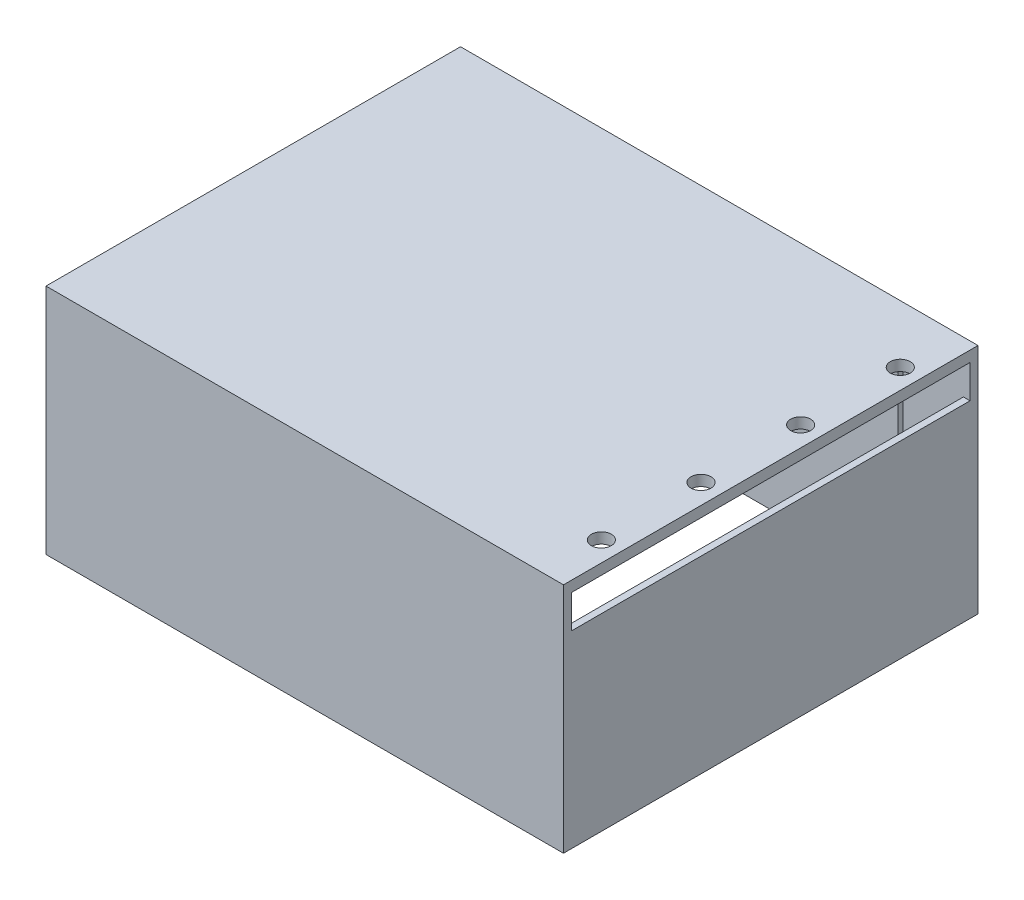
from build123d import *

# Parameters (mm, degrees)
SKETCH1_W           = 77.9
SKETCH1_H           = 62.4
BOSS_EXTRUDE1_DEPTH = 35
SKETCH4_W           = 73.9
SKETCH4_H           = 58.4
CUT_EXTRUDE1_DEPTH  = 33.39
SKETCH7_W           = 13.133474477
SKETCH7_H           = 5
CUT_EXTRUDE6_DEPTH  = 15
SKETCH11_W          = 9.956525523
SKETCH11_H          = 5.15
CUT_EXTRUDE8_DEPTH  = 10
SKETCH12_W          = 17
SKETCH12_H          = 16
CUT_EXTRUDE9_DEPTH  = 10
SKETCH14_W          = 60
SKETCH14_H          = 5
CUT_EXTRUDE10_DEPTH = 10
CUT_EXTRUDE12_START = -33.39
SKETCH16_W          = 9.076585482
SKETCH16_H          = 60
CUT_EXTRUDE12_DEPTH = 33.39
SKETCH15_R          = 1.5
CUT_EXTRUDE11_DEPTH = 10
SKETCH18_W          = 1.605745829
SKETCH18_H          = 60
BOSS_EXTRUDE2_DEPTH = 10


with BuildPart() as part:
    # Sketch1 → Boss-Extrude1 (new body)
    with BuildSketch(Plane(origin=(0, 0, 0), x_dir=(1, 0, 0), z_dir=(0, 1, 0))):
        with Locations((38.95, 31.2)):
            Rectangle(SKETCH1_W, SKETCH1_H)
    extrude(amount=BOSS_EXTRUDE1_DEPTH)

    # Sketch4 → Cut-Extrude1 (cut)
    with BuildSketch(Plane.XZ):
        with Locations((38.95, -31.2)):
            Rectangle(SKETCH4_W, SKETCH4_H)
    extrude(amount=-CUT_EXTRUDE1_DEPTH, mode=Mode.SUBTRACT)

    # Sketch7 → Cut-Extrude6 (cut)
    with BuildSketch(Plane.ZY):
        with Locations((-42.333262762, 2.5)):
            Rectangle(SKETCH7_W, SKETCH7_H)
    extrude(amount=-CUT_EXTRUDE6_DEPTH, mode=Mode.SUBTRACT)

    # Sketch11 → Cut-Extrude8 (cut)
    with BuildSketch(Plane.ZY):
        with Locations((-12.508262762, 2.575)):
            Rectangle(SKETCH11_W, SKETCH11_H)
    extrude(amount=-CUT_EXTRUDE8_DEPTH, mode=Mode.SUBTRACT)

    # Sketch12 → Cut-Extrude9 (cut)
    with BuildSketch(Plane.ZY):
        with Locations((-43.9, 17)):
            Rectangle(SKETCH12_W, SKETCH12_H)
    extrude(amount=-CUT_EXTRUDE9_DEPTH, mode=Mode.SUBTRACT)

    # Sketch14 → Cut-Extrude10 (cut)
    with BuildSketch(Plane(origin=(77.9, 0, 0), x_dir=(0, 0, -1), z_dir=(1, 0, 0))):
        with Locations((31.2, 30.89)):
            Rectangle(SKETCH14_W, SKETCH14_H)
    extrude(amount=-CUT_EXTRUDE10_DEPTH, mode=Mode.SUBTRACT)

    # Sketch16 → Cut-Extrude12 (cut)
    with BuildSketch(Plane(origin=(0, 0, 0), x_dir=(-1, 0, 0), z_dir=(0, -1, 0)).offset(CUT_EXTRUDE12_START)):
        with Locations((-72.361707259, 31.2)):
            Rectangle(SKETCH16_W, SKETCH16_H)
    extrude(amount=CUT_EXTRUDE12_DEPTH, mode=Mode.SUBTRACT)

    # Sketch15 → Cut-Extrude11 (cut)
    with BuildSketch(Plane(origin=(0, 33.39, 0), x_dir=(-1, 0, 0), z_dir=(0, -1, 0))):
        with Locations(Location((-74.9, 8.7, 0), (0, 0, 90))):
            Circle(SKETCH15_R)
        with Locations(Location((-74.9, 23.7, 0), (0, 0, 90))):
            Circle(SKETCH15_R)
        with Locations(Location((-74.9, 38.7, 0), (0, 0, 90))):
            Circle(SKETCH15_R)
        with Locations(Location((-74.9, 53.7, 0), (0, 0, 90))):
            Circle(SKETCH15_R)
    extrude(amount=-CUT_EXTRUDE11_DEPTH, mode=Mode.SUBTRACT)

    # Sketch18 → Boss-Extrude2 (add)
    with BuildSketch(Plane(origin=(0, 0, 0), x_dir=(-1, 0, 0), z_dir=(0, -1, 0))):
        with Locations((-76.097127086, 31.2)):
            Rectangle(SKETCH18_W, SKETCH18_H)
    extrude(amount=-BOSS_EXTRUDE2_DEPTH)

    # Sketch19 → Revolve2 (revolve)
    with BuildSketch(Plane.ZY.offset(-75.294254171)):
        with BuildLine():
            Line((-31.2, 3.5), (-31.2, 1.5))
            ThreePointArc((-31.2, 1.5), (-30.2, 2.5), (-31.2, 3.5))
        make_face()
    revolve(axis=Axis((75.294254171, 3.5, -31.2), (0, -1, 0)))

    # Sketch17 → Revolve4 (revolve)
    with BuildSketch(Plane.ZY.offset(-2)):
        with BuildLine():
            ThreePointArc((-31.2, 3.5), (-32.2, 2.5), (-31.2, 1.5))
            Line((-31.2, 1.5), (-31.2, 3.5))
        make_face()
    revolve(axis=Axis((2, 3.5, -31.2), (0, -1, 0)))


solid = part.part
